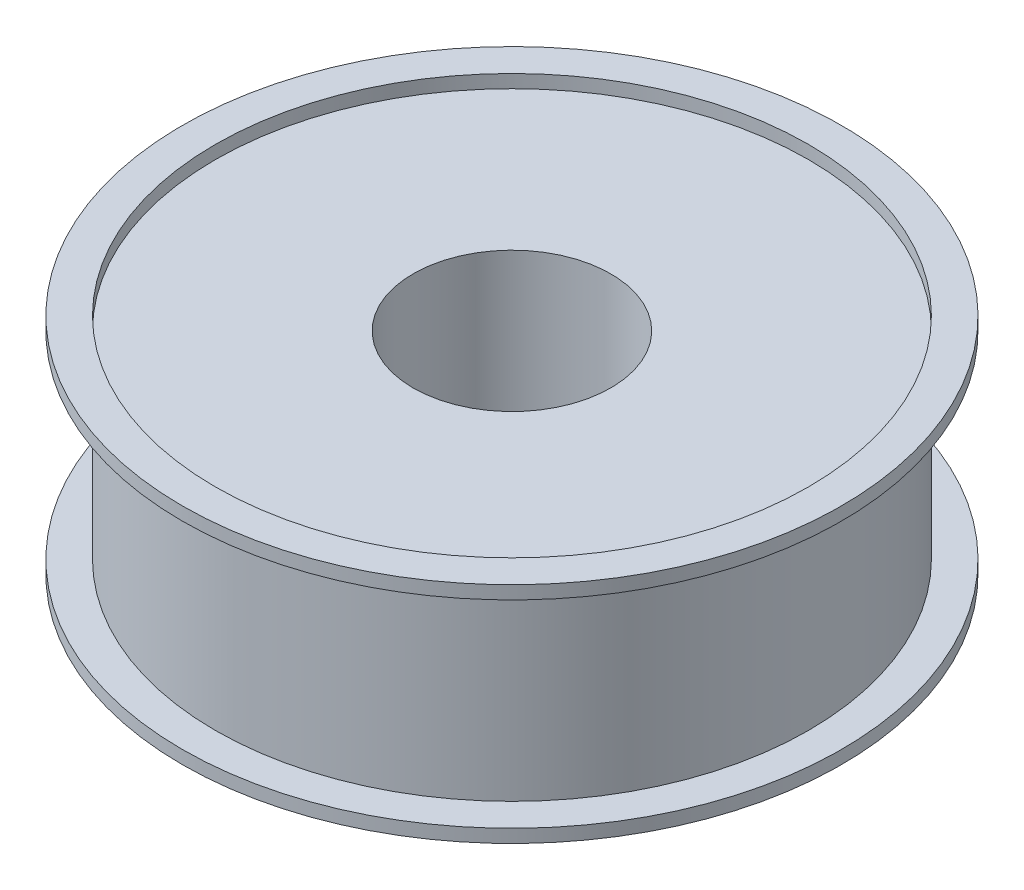
from build123d import *

# Parameters (mm, degrees)
SKETCH1_R           = 100
SKETCH1_R_2         = 90
BOSS_EXTRUDE1_DEPTH = 4
SKETCH2_R           = 90
SKETCH2_R_2         = 30
BOSS_EXTRUDE2_DEPTH = 60
SKETCH3_R           = 100
SKETCH3_R_2         = 30
BOSS_EXTRUDE3_DEPTH = 4
CUT_EXTRUDE1_START  = -4
SKETCH4_R           = 90
CUT_EXTRUDE1_DEPTH  = 4


with BuildPart() as part:
    # Sketch1 → Boss-Extrude1 (new body)
    with BuildSketch(Plane(origin=(0, 0, 0), x_dir=(1, 0, 0), z_dir=(0, 1, 0))):
        with Locations(Location((0, 0, 0), (0, 0, 270))):
            Circle(SKETCH1_R)
        with Locations(Location((0, 0, 0), (0, 0, 270))):
            Circle(SKETCH1_R_2, mode=Mode.SUBTRACT)
    extrude(amount=BOSS_EXTRUDE1_DEPTH)


with BuildPart() as body_2:
    # Sketch2 → Boss-Extrude2 (new body)
    with BuildSketch(Plane(origin=(0, 4, 0), x_dir=(1, 0, 0), z_dir=(0, 1, 0))):
        with Locations(Location((0, 0, 0), (0, 0, 270))):
            Circle(SKETCH2_R)
        with Locations(Location((0, 0, 0), (0, 0, 270))):
            Circle(SKETCH2_R_2, mode=Mode.SUBTRACT)
    extrude(amount=BOSS_EXTRUDE2_DEPTH)

    # Sketch3 → Boss-Extrude3 (add)
    with BuildSketch(Plane(origin=(0, 64, 0), x_dir=(1, 0, 0), z_dir=(0, 1, 0))):
        with Locations(Location((0, 0, 0), (0, 0, 270))):
            Circle(SKETCH3_R)
        with Locations(Location((0, 0, 0), (0, 0, 270))):
            Circle(SKETCH3_R_2, mode=Mode.SUBTRACT)
    extrude(amount=BOSS_EXTRUDE3_DEPTH)

    # Sketch4 → Cut-Extrude1 (cut)
    with BuildSketch(Plane(origin=(0, 68, 0), x_dir=(1, 0, 0), z_dir=(0, 1, 0)).offset(CUT_EXTRUDE1_START)):
        with Locations(Location((0, 0, 0), (0, 0, 270))):
            Circle(SKETCH4_R)
    extrude(amount=CUT_EXTRUDE1_DEPTH, mode=Mode.SUBTRACT)


with BuildPart() as cut_extrude1_piece_1:
    # of the separate pieces the step leaves, piece 1, a body of its own (cut_extrude1_pieces)
    add(body_2.part.solids().sort_by_distance((0, 4, 90))[0])


with BuildPart() as cut_extrude1_piece_2:
    # of the separate pieces the step leaves, piece 2, a body of its own (cut_extrude1_pieces)
    add(body_2.part.solids().sort_by_distance((0, 64, 100))[0])


solid = Compound([part.part, cut_extrude1_piece_1.part, cut_extrude1_piece_2.part])
